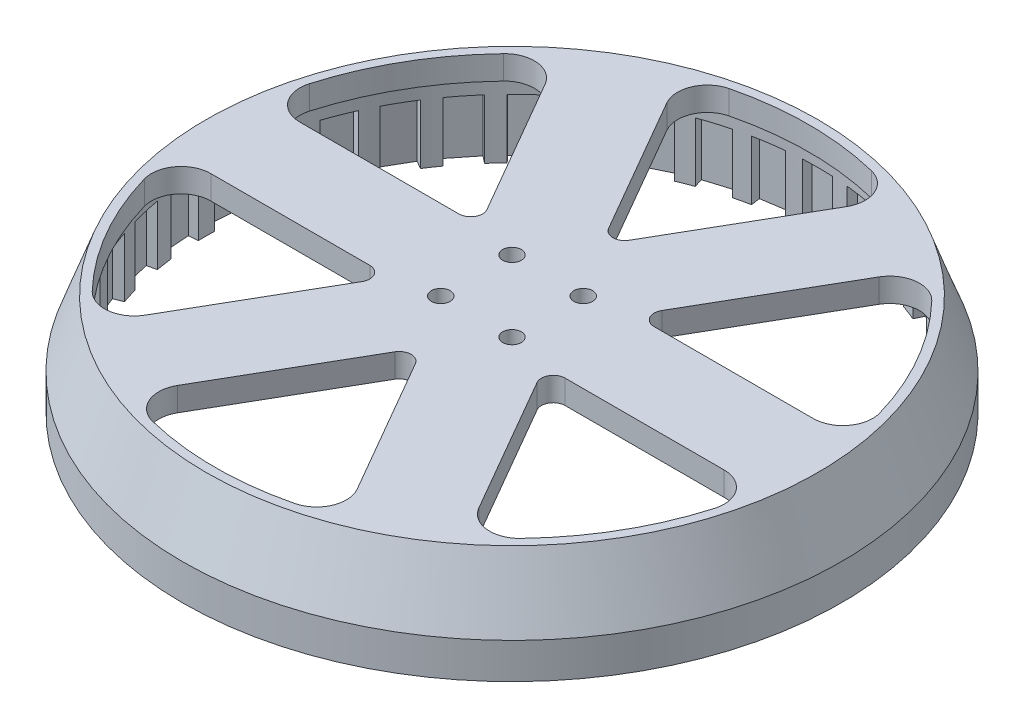
from build123d import *

# Parameters (mm, degrees)
SLOT_CUT_DEPTH           = 81.308779097
SLOT_CUT_PATTERN_COUNT   = 6
MAGNET_START             = -10
MAGNET_SLOTS_DEPTH       = 10
MAGNET_CUT_PATTERN_COUNT = 42
SKETCH5_R                = 1.575
CUT_EXTRUDE1_DEPTH       = 10
CHAMFER1_SIZE            = 4
CHAMFER1_SIZE2           = 10.989909678


with BuildPart() as part:
    # Sketch1 → Main Revolve (revolve)
    with BuildSketch(Plane.XY, mode=Mode.PRIVATE) as main_revolve_sk:
        Polygon((0, 29), (0, 33), (55.5, 33), (55.5, 16), (51.5, 16), (51.5, 29), align=None)
    revolve(main_revolve_sk.sketch.rotate(Axis((0, 0, 0), (0, 1, 0)), 90), axis=Axis((0, 0, 0), (0, 1, 0)))

    # Sketch2 → Slot Cut (cut, through all)
    with BuildSketch(Plane(origin=(0, 33, 0), x_dir=(1, 0, 0), z_dir=(0, 1, 0))):
        with BuildLine():
            Line((15.119330054, 41.18744783), (1.732050808, 18))
            ThreePointArc((1.732050808, 18), (0, 17), (-1.732050808, 18))
            Line((-1.732050808, 18), (-15.119330054, 41.18744783))
            ThreePointArc((-15.119330054, 41.18744783), (-15.389548669, 45.646228074), (-11.988003372, 48.5416087))
            ThreePointArc((-11.988003372, 48.5416087), (0, 50), (11.988003372, 48.5416087))
            ThreePointArc((11.988003372, 48.5416087), (15.389548669, 45.646228074), (15.119330054, 41.18744783))
        make_face()
    slot_cut = extrude(amount=-SLOT_CUT_DEPTH, mode=Mode.SUBTRACT)

    # Slot Cut Pattern: Slot Cut ×6 about axis
    slot_cut_pattern_axis = Axis((0, 0, 0), (0, 1, 0))
    for i in range(1, SLOT_CUT_PATTERN_COUNT):
        add(slot_cut.rotate(slot_cut_pattern_axis, i * 360 / SLOT_CUT_PATTERN_COUNT), mode=Mode.SUBTRACT)

    # Sketch4 → Magnet Slots (cut)
    with BuildSketch(Plane.XZ.offset(-16).offset(MAGNET_START)):
        with BuildLine():
            Line((-2.5, 53), (2.5, 53))
            Line((2.5, 53), (2.5, 51.439284598))
            ThreePointArc((2.5, 51.439284598), (0, 51.5), (-2.5, 51.439284598))
            Line((-2.5, 51.439284598), (-2.5, 53))
        make_face()
    magnet_slots = extrude(amount=MAGNET_SLOTS_DEPTH, mode=Mode.SUBTRACT)

    # Magnet Cut Pattern: Magnet Slots ×42 about axis
    magnet_cut_pattern_axis = Axis((0, 0, 0), (0, 1, 0))
    for i in range(1, MAGNET_CUT_PATTERN_COUNT):
        add(magnet_slots.rotate(magnet_cut_pattern_axis, i * 360 / MAGNET_CUT_PATTERN_COUNT), mode=Mode.SUBTRACT)

    # Sketch5 → Cut-Extrude1 (cut)
    with BuildSketch(Plane(origin=(0, 33, 0), x_dir=(1, 0, 0), z_dir=(0, 1, 0))):
        with Locations(Location((-6, 6, 0), (0, 0, 270))):
            Circle(SKETCH5_R)
        with Locations(Location((6, 6, 0), (0, 0, 270))):
            Circle(SKETCH5_R)
        with Locations(Location((6, -6, 0), (0, 0, 270))):
            Circle(SKETCH5_R)
        with Locations(Location((-6, -6, 0), (0, 0, 270))):
            Circle(SKETCH5_R)
    extrude(amount=-CUT_EXTRUDE1_DEPTH, mode=Mode.SUBTRACT)

    # Chamfer1
    chamfer1_edges = [part.edges().sort_by_distance(p)[0] for p in [
        (0, 33, 55.5),
    ]]
    chamfer1_side = [part.faces().sort_by_distance(p)[0] for p in [
        (0, 33, 0),
    ]]
    chamfer(chamfer1_edges, length=CHAMFER1_SIZE, length2=CHAMFER1_SIZE2, reference=chamfer1_side[0])


solid = part.part
